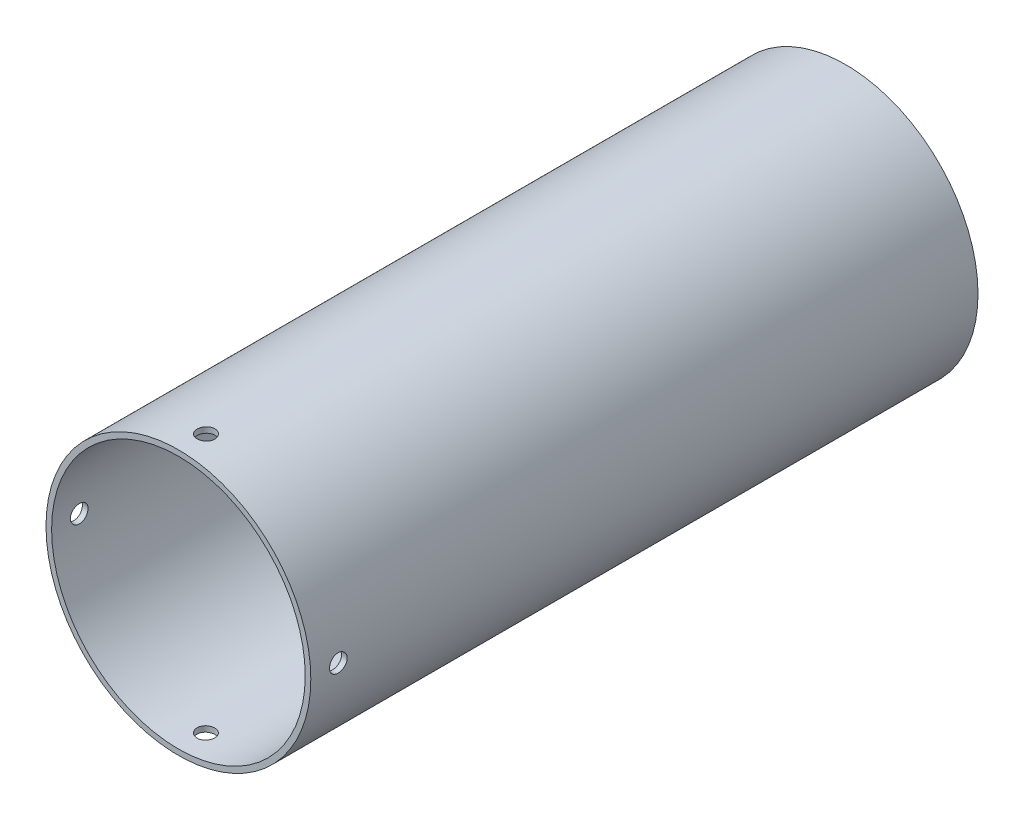
from build123d import *

# Parameters (mm, degrees)
SKETCH1_R               = 24.016
SKETCH1_R_2             = 23
EXTRUDE_THIN1_DEPTH     = 120
BOSS_EXTRUDE1_START     = 1.016
SKETCH2_R               = 24.016
BOSS_EXTRUDE1_DEPTH     = 1.016
CUT_EXTRUDE1_DEPTH      = 125.713818448
CUT_EXTRUDE1_DEPTH_BACK = 125.713818448
SKETCH3_R               = 1.6
CUT_EXTRUDE2_DEPTH      = 125.713818587
CUT_EXTRUDE2_DEPTH_BACK = 125.713818587
SKETCH4_R               = 1.6


with BuildPart() as part:
    # Sketch1 → Extrude-Thin1 (new body)
    with BuildSketch(Plane.XY):
        Circle(SKETCH1_R)
        Circle(SKETCH1_R_2, mode=Mode.SUBTRACT)
    extrude(amount=EXTRUDE_THIN1_DEPTH)

    # Sketch2 → Boss-Extrude1 (add)
    with BuildSketch(Plane(origin=(0, 0, 0), x_dir=(-1, 0, 0), z_dir=(0, 0, -1)).offset(BOSS_EXTRUDE1_START)):
        Circle(SKETCH2_R)
    extrude(amount=-BOSS_EXTRUDE1_DEPTH)

    # Sketch3 → Cut-Extrude1 (cut, two sides: drawn at the far end of the back side and taken through both)
    with BuildSketch(Plane(origin=(0, 0, 0), x_dir=(1, 0, 0), z_dir=(0, 1, 0)).offset(-CUT_EXTRUDE1_DEPTH_BACK)):
        with Locations(Location((0, -115, 0), (0, 0, 270))):
            Circle(SKETCH3_R)
    extrude(amount=CUT_EXTRUDE1_DEPTH + CUT_EXTRUDE1_DEPTH_BACK, mode=Mode.SUBTRACT)

    # Sketch4 → Cut-Extrude2 (cut, two sides: drawn at the far end of the back side and taken through both)
    with BuildSketch(Plane(origin=(0, 0, 0), x_dir=(0, 0, -1), z_dir=(1, 0, 0)).offset(-CUT_EXTRUDE2_DEPTH_BACK)):
        with Locations((-115, 0)):
            Circle(SKETCH4_R)
    extrude(amount=CUT_EXTRUDE2_DEPTH + CUT_EXTRUDE2_DEPTH_BACK, mode=Mode.SUBTRACT)


solid = part.part
